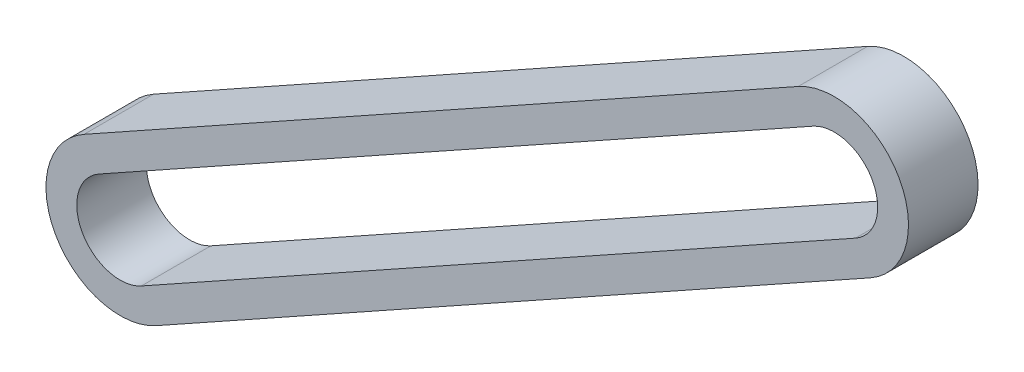
from build123d import *

# Parameters (mm, degrees)
BOSS_EXTRUDE1_DEPTH = 3


with BuildPart() as part:
    # Sketch1 → Boss-Extrude1 (new body)
    with BuildSketch(Plane.XY):
        with BuildLine():
            Line((-1.559297234, 2.794385824), (29.240702766, 19.981115875))
            ThreePointArc((29.240702766, 19.981115875), (33.594385824, 18.746027285), (32.359297234, 14.392344226))
            Line((32.359297234, 14.392344226), (1.559297234, -2.794385824))
            ThreePointArc((1.559297234, -2.794385824), (-2.794385824, -1.559297234), (-1.559297234, 2.794385824))
        make_face()
        with BuildLine():
            Line((-0.912188882, 1.634715707), (29.887811118, 18.821445758))
            ThreePointArc((29.887811118, 18.821445758), (32.434715707, 18.098918933), (31.712188882, 15.552014343))
            Line((31.712188882, 15.552014343), (0.912188882, -1.634715707))
            ThreePointArc((0.912188882, -1.634715707), (-1.634715707, -0.912188882), (-0.912188882, 1.634715707))
        make_face(mode=Mode.SUBTRACT)
    extrude(amount=-BOSS_EXTRUDE1_DEPTH)


solid = part.part
